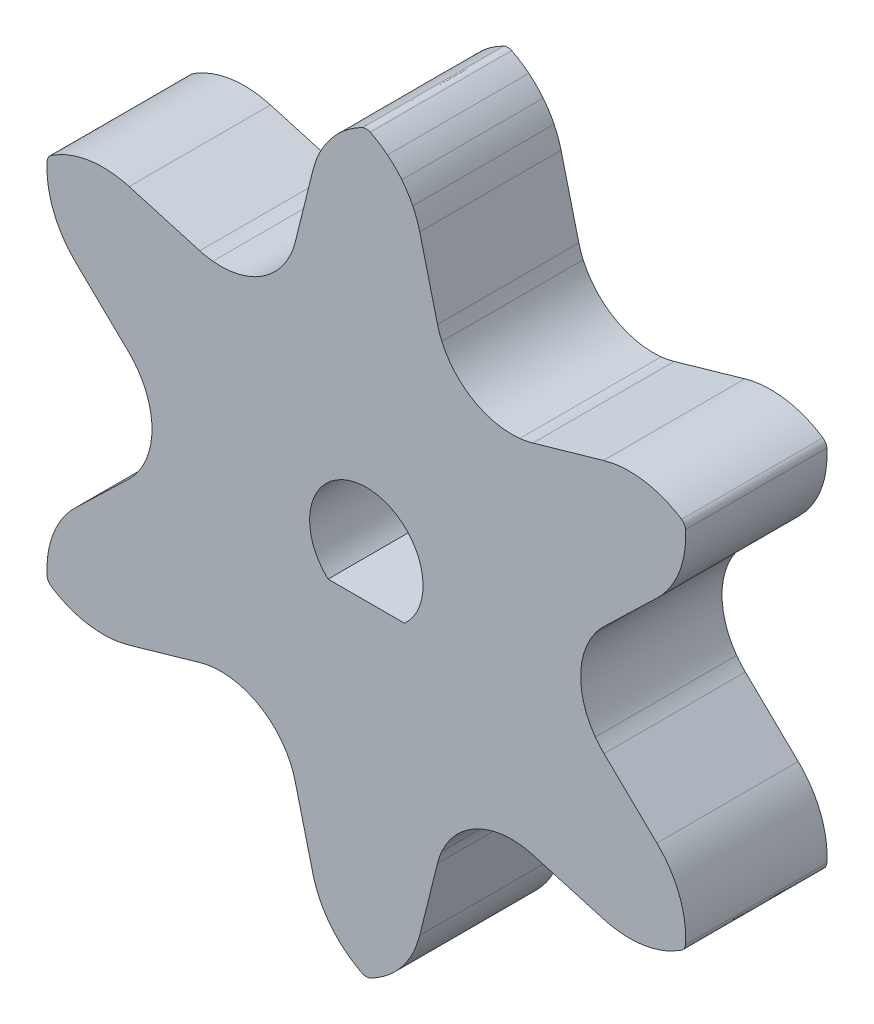
from build123d import *

# Parameters (mm, degrees)
BOSS_EXTRUDE1_DEPTH = 4.7625
BOSS_EXTRUDE2_START = -4.7625
BOSS_EXTRUDE2_DEPTH = 4.7625


with BuildPart() as part:
    # Sketch1 → Boss-Extrude1 (new body)
    with BuildSketch(Plane.XY):
        with BuildLine():
            Line((-9.507346898, -10.258391726), (-8.908113007, -12.661787593))
            ThreePointArc((-8.908113007, -12.661787593), (-8.303157018, -13.881491249), (-7.2429575, -14.735672577))
            ThreePointArc((-7.2429575, -14.735672577), (-7.10920631, -14.767138372), (-6.975455121, -14.735672577))
            ThreePointArc((-6.975455121, -14.735672577), (-5.915255603, -13.881491249), (-5.310299614, -12.661787593))
            Line((-5.310299614, -12.661787593), (-4.711065722, -10.258391726))
            ThreePointArc((-4.711065722, -10.258391726), (-4.647570891, -10.043856855), (-4.565714834, -9.835634882))
            ThreePointArc((-4.565714834, -9.835634882), (-3.49859631, -8.649390472), (-1.937719254, -8.318360926))
            ThreePointArc((-1.937719254, -8.318360926), (-1.716465707, -8.351582488), (-1.498925643, -8.403861787))
            Line((-1.498925643, -8.403861787), (0.882093179, -9.086607947))
            ThreePointArc((0.882093179, -9.086607947), (2.240865525, -9.172552521), (3.510708013, -8.681483469))
            ThreePointArc((3.510708013, -8.681483469), (3.604833786, -8.581384439), (3.644459203, -8.449819613))
            ThreePointArc((3.644459203, -8.449819613), (3.434816232, -7.104569234), (2.680999875, -5.970810151))
            Line((2.680999875, -5.970810151), (0.899214945, -4.250160445))
            ThreePointArc((0.899214945, -4.250160445), (0.745169712, -4.087904873), (0.605772222, -3.912904461))
            ThreePointArc((0.605772222, -3.912904461), (0.11201369, -2.395630505), (0.605772222, -0.878356549))
            ThreePointArc((0.605772222, -0.878356549), (0.745169712, -0.703356138), (0.899214945, -0.541100566))
            Line((0.899214945, -0.541100566), (2.680999444, 1.179548724))
            ThreePointArc((2.680999444, 1.179548724), (3.434816124, 2.313307944), (3.644459203, 3.658558603))
            ThreePointArc((3.644459203, 3.658558603), (3.604833786, 3.790123428), (3.510708013, 3.890222459))
            ThreePointArc((3.510708013, 3.890222459), (2.240865525, 4.38129151), (0.882093179, 4.295346937))
            Line((0.882093179, 4.295346937), (-1.498925643, 3.612600776))
            ThreePointArc((-1.498925643, 3.612600776), (-1.716465707, 3.560321477), (-1.937719254, 3.527099916))
            ThreePointArc((-1.937719254, 3.527099916), (-3.49859631, 3.858129461), (-4.565714834, 5.044373871))
            ThreePointArc((-4.565714834, 5.044373871), (-4.647570891, 5.252595845), (-4.711065722, 5.467130715))
            Line((-4.711065722, 5.467130715), (-5.310299614, 7.870526582))
            ThreePointArc((-5.310299614, 7.870526582), (-5.915255603, 9.090230239), (-6.975455121, 9.944411567))
            ThreePointArc((-6.975455121, 9.944411567), (-7.10920631, 9.975877362), (-7.2429575, 9.944411567))
            ThreePointArc((-7.2429575, 9.944411567), (-8.303157018, 9.090230239), (-8.908113007, 7.870526582))
            Line((-8.908113007, 7.870526582), (-9.507346898, 5.467130715))
            ThreePointArc((-9.507346898, 5.467130715), (-9.570841729, 5.252595845), (-9.652697786, 5.044373871))
            ThreePointArc((-9.652697786, 5.044373871), (-10.71981631, 3.858129461), (-12.280693367, 3.527099916))
            ThreePointArc((-12.280693367, 3.527099916), (-12.501946914, 3.560321477), (-12.719486977, 3.612600776))
            Line((-12.719486977, 3.612600776), (-15.100505799, 4.295346937))
            ThreePointArc((-15.100505799, 4.295346937), (-16.459278145, 4.38129151), (-17.729120634, 3.890222459))
            ThreePointArc((-17.729120634, 3.890222459), (-17.823246406, 3.790123428), (-17.862871823, 3.658558603))
            ThreePointArc((-17.862871823, 3.658558603), (-17.653228853, 2.313308223), (-16.899412496, 1.17954914))
            Line((-16.899412496, 1.17954914), (-15.117627565, -0.541100566))
            ThreePointArc((-15.117627565, -0.541100566), (-14.963582333, -0.703356138), (-14.824184843, -0.878356549))
            ThreePointArc((-14.824184843, -0.878356549), (-14.33042631, -2.395630505), (-14.824184843, -3.912904461))
            ThreePointArc((-14.824184843, -3.912904461), (-14.963582333, -4.087904873), (-15.117627565, -4.250160445))
            Line((-15.117627565, -4.250160445), (-16.899412065, -5.970809735))
            ThreePointArc((-16.899412065, -5.970809735), (-17.653228744, -7.104568955), (-17.862871823, -8.449819613))
            ThreePointArc((-17.862871823, -8.449819613), (-17.823246406, -8.581384439), (-17.729120634, -8.681483469))
            ThreePointArc((-17.729120634, -8.681483469), (-16.459278145, -9.172552521), (-15.100505799, -9.086607947))
            Line((-15.100505799, -9.086607947), (-12.719486977, -8.403861787))
            ThreePointArc((-12.719486977, -8.403861787), (-12.501946914, -8.351582488), (-12.280693367, -8.318360926))
            ThreePointArc((-12.280693367, -8.318360926), (-10.71981631, -8.649390472), (-9.652697786, -9.835634882))
            ThreePointArc((-9.652697786, -9.835634882), (-9.570841729, -10.043856855), (-9.507346898, -10.258391726))
        make_face()
        with BuildLine():
            Line((-5.795813757, -3.870630505), (-8.422598864, -3.870630505))
            ThreePointArc((-8.422598864, -3.870630505), (-7.10920631, -0.420630505), (-5.795813757, -3.870630505))
        make_face(mode=Mode.SUBTRACT)
    extrude(amount=BOSS_EXTRUDE1_DEPTH)

    # Sketch4 → Boss-Extrude2 (add)
    with BuildSketch(Plane.XY.offset(4.7625).offset(BOSS_EXTRUDE2_START)):
        with BuildLine():
            Line((-8.422598864, -3.870630505), (-5.795813757, -3.870630505))
            ThreePointArc((-5.795813757, -3.870630505), (-7.10920631, -0.420630505), (-8.422598864, -3.870630505))
        make_face()
        with BuildLine():
            Line((-8.398198164, -3.807130505), (-5.820214456, -3.807130505))
            ThreePointArc((-5.820214456, -3.807130505), (-7.10920631, -0.484130505), (-8.398198164, -3.807130505))
        make_face(mode=Mode.SUBTRACT)
    extrude(amount=BOSS_EXTRUDE2_DEPTH)


solid = part.part
